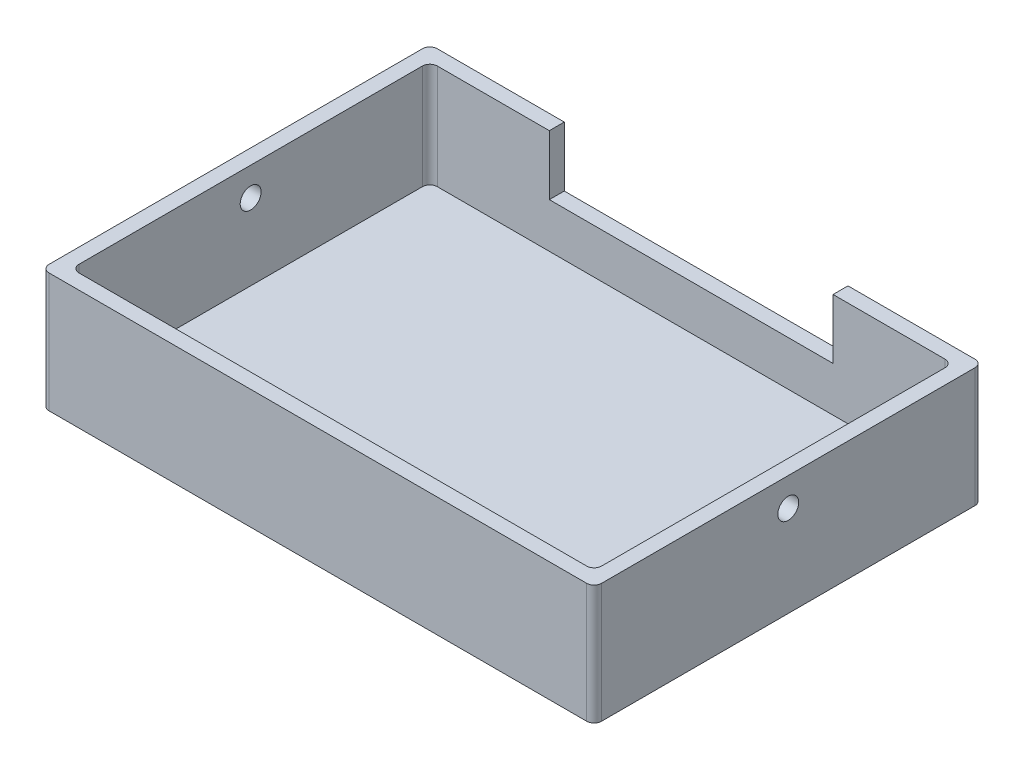
from build123d import *

# Parameters (mm, degrees)
BOSS_EXTRUDE1_DEPTH = 10
BOSS_EXTRUDE2_DEPTH = 70
SKETCH5_W           = 190
SKETCH5_H           = 80
CUT_EXTRUDE1_DEPTH  = 70
SKETCH6_R           = 7
CUT_EXTRUDE2_DEPTH  = 401.249921924


with BuildPart() as part:
    # Sketch2 → Boss-Extrude1 (new body)
    with BuildSketch(Plane(origin=(0, 0, 0), x_dir=(1, 0, 0), z_dir=(0, 1, 0))):
        with BuildLine():
            Line((-180, -130), (180, -130))
            ThreePointArc((180, -130), (183.535533906, -128.535533906), (185, -125))
            Line((185, -125), (185, 125))
            ThreePointArc((185, 125), (183.535533906, 128.535533906), (180, 130))
            Line((180, 130), (-180, 130))
            ThreePointArc((-180, 130), (-183.535533906, 128.535533906), (-185, 125))
            Line((-185, 125), (-185, -125))
            ThreePointArc((-185, -125), (-183.535533906, -128.535533906), (-180, -130))
        make_face()
    extrude(amount=BOSS_EXTRUDE1_DEPTH)

    # Sketch3 → Boss-Extrude2 (add)
    with BuildSketch(Plane(origin=(0, 10, 0), x_dir=(1, 0, 0), z_dir=(0, 1, 0))):
        with BuildLine():
            Line((180, 130), (-180, 130))
            ThreePointArc((-180, 130), (-183.535533906, 128.535533906), (-185, 125))
            Line((-185, 125), (-185, -125))
            ThreePointArc((-185, -125), (-183.535533906, -128.535533906), (-180, -130))
            Line((-180, -130), (180, -130))
            ThreePointArc((180, -130), (183.535533906, -128.535533906), (185, -125))
            Line((185, -125), (185, 125))
            ThreePointArc((185, 125), (183.535533906, 128.535533906), (180, 130))
        make_face()
        with BuildLine():
            Line((170, 120), (-170, 120))
            ThreePointArc((-170, 120), (-173.535533906, 118.535533906), (-175, 115))
            Line((-175, 115), (-175, -115))
            ThreePointArc((-175, -115), (-173.535533906, -118.535533906), (-170, -120))
            Line((-170, -120), (170, -120))
            ThreePointArc((170, -120), (173.535533906, -118.535533906), (175, -115))
            Line((175, -115), (175, 115))
            ThreePointArc((175, 115), (173.535533906, 118.535533906), (170, 120))
        make_face(mode=Mode.SUBTRACT)
    extrude(amount=BOSS_EXTRUDE2_DEPTH)

    # Sketch5 → Cut-Extrude1 (cut)
    with BuildSketch(Plane(origin=(0, 0, -130), x_dir=(-1, 0, 0), z_dir=(0, 0, -1))):
        with Locations((0, 80)):
            Rectangle(SKETCH5_W, SKETCH5_H)
    extrude(amount=-CUT_EXTRUDE1_DEPTH, mode=Mode.SUBTRACT)

    # Sketch6 → Cut-Extrude2 (cut, through all)
    with BuildSketch(Plane(origin=(185, 0, 0), x_dir=(0, 0, -1), z_dir=(1, 0, 0))):
        with Locations((0, 61)):
            Circle(SKETCH6_R)
    extrude(amount=-CUT_EXTRUDE2_DEPTH, mode=Mode.SUBTRACT)


solid = part.part
